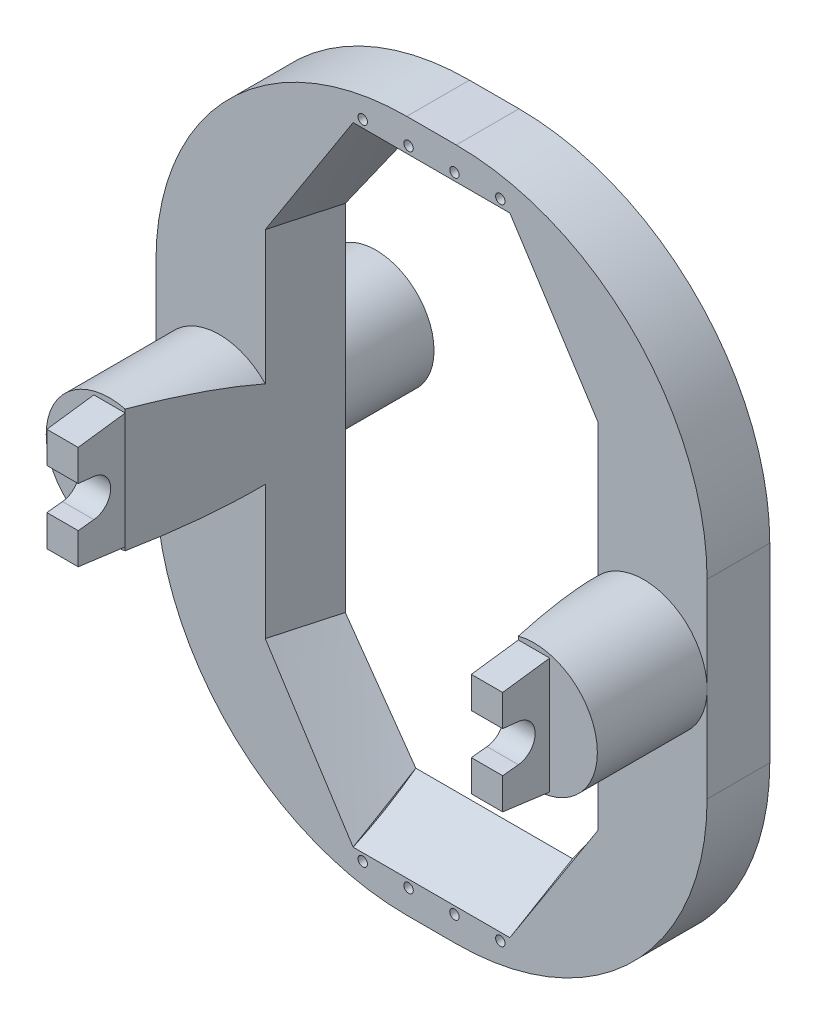
from build123d import *

# Parameters (mm, degrees)
SKETCH_1_R                      = 18.5
SKETCH_1_R_2                    = 15
EXTRUDE_1_DEPTH                 = 30
SKETCH_2_R                      = 20.2
SKETCH_2_R_2                    = 15
EXTRUDE_2_DEPTH                 = 5
SKETCH_3_R                      = 20.2
EXTRUDE_3_DEPTH                 = 50
EXTRUDE_4_DEPTH                 = 5
EXTRUDE_5_DEPTH                 = 20
FILLET_1_R                      = 80
CUT_EXTRUDE_2_REACH             = 174.924
SKETCH_7_R                      = 110
CUT_EXTRUDE_2_DIRECTION_2_REACH = 174.924
SKETCH_11_R                     = 1.5
CUT_EXTRUDE_3_DEPTH             = 25
SKETCH_12_W                     = 57.061720969
SKETCH_12_H                     = 113.011504976
CUT_EXTRUDE_4_DEPTH             = 20


with BuildPart() as part:
    # 草图1 → 凸台-拉伸1 (new body)
    with BuildSketch(Plane.XY):
        Circle(SKETCH_1_R)
        Circle(SKETCH_1_R_2, mode=Mode.SUBTRACT)
    extrude(amount=EXTRUDE_1_DEPTH)

    # 草图2 → 凸台-拉伸2 (add)
    with BuildSketch(Plane.XY.offset(30)):
        Circle(SKETCH_2_R)
        Circle(SKETCH_2_R_2, mode=Mode.SUBTRACT)
    extrude_2 = extrude(amount=EXTRUDE_2_DEPTH)

    # 草图3 → 凸台-拉伸3 (add)
    with BuildSketch(Plane.XY.offset(35)):
        Circle(SKETCH_3_R)
    extrude_3 = extrude(amount=EXTRUDE_3_DEPTH)

    # 草图5 → 凸台-拉伸4 (add, symmetric)
    with BuildSketch(Plane(origin=(0, 0, 0), x_dir=(0, -1, 0), z_dir=(1, 0, 0))):
        with BuildLine():
            Line((-18.5, -85), (18.5, -85))
            Line((18.5, -85), (16.5, -100))
            Line((16.5, -100), (6.5, -100))
            Line((6.5, -100), (5.966081527, -95))
            ThreePointArc((5.966081527, -95), (0, -89.637080228), (-5.966081527, -95))
            Line((-5.966081527, -95), (-6.5, -100))
            Line((-6.5, -100), (-16.5, -100))
            Line((-16.5, -100), (-18.5, -85))
        make_face()
    extrude_4 = extrude(amount=EXTRUDE_4_DEPTH, both=True)

    # 草图6 → 凸台-拉伸5 (add)
    with BuildSketch(Plane(origin=(0, 0, 30), x_dir=(-1, 0, 0), z_dir=(0, 0, -1))):
        Polygon((20.2, 0), (20.2, 110.346509277), (-155.6, 110.346509277), (-155.6, 0), (-155.6, -110.346509277), (20.2, -110.346509277), align=None)
        Polygon((-115.2, 56.505752488), (-92.7, 56.505752488), (-92.7, 85), (-42.7, 85), (-42.7, 56.505752488), (-20.2, 56.505752488), (-20.2, -56.505752488), (-42.7, -56.505752488), (-42.7, -85), (-92.7, -85), (-92.7, -56.505752488), (-115.2, -56.505752488), align=None, mode=Mode.SUBTRACT)
    extrude(amount=-EXTRUDE_5_DEPTH)

    # 镜向1: 凸台-拉伸2, 凸台-拉伸3, 凸台-拉伸4 across plane
    add(extrude_2.mirror(Plane.ZY.offset(-67.7)))
    add(extrude_3.mirror(Plane.ZY.offset(-67.7)))
    add(extrude_4.mirror(Plane.ZY.offset(-67.7)))

    # 圆角1
    fillet_1_edges = [part.edges().sort_by_distance(p)[0] for p in [
        (-20.2, 110.346509277, 40),
        (-20.2, -110.346509277, 40),
        (155.6, -110.346509277, 40),
        (155.6, 110.346509277, 40),
    ]]
    fillet(fillet_1_edges, radius=FILLET_1_R)

    # 切除-拉伸2: up to this face of the body (flat: up to its plane)
    cut_extrude_2_end = Plane(part.part.faces().sort_by_distance((42.7, 70.752876244, 40))[0])
    # 草图7 → 切除-拉伸2 (cut, up to the picked face)
    with BuildSketch(Plane(origin=(67.7, 0, 0), x_dir=(0, 0, -1), z_dir=(1, 0, 0)), mode=Mode.PRIVATE) as cut_extrude_2_sk1:
        with Locations((-95.637080228, 0)):
            Circle(SKETCH_7_R)
    cut_extrude_2_tool1 = split(extrude(cut_extrude_2_sk1.sketch, amount=-CUT_EXTRUDE_2_REACH, mode=Mode.PRIVATE), bisect_by=cut_extrude_2_end, keep=Keep.BOTH, mode=Mode.PRIVATE)
    add(cut_extrude_2_tool1.solids().sort_by(Axis((67.7, 0, 95.63708), (-1, 0, 0)))[0], mode=Mode.SUBTRACT)

    # 切除-拉伸2 direction 2: up to this face of the body (flat: up to its plane)
    cut_extrude_2_direction_2_end = Plane(part.part.faces().sort_by_distance((92.7, 70.752876244, 40))[0])
    # 草图7 → 切除-拉伸2 direction 2 (cut, up to the picked face)
    with BuildSketch(Plane(origin=(67.7, 0, 0), x_dir=(0, 0, -1), z_dir=(1, 0, 0)), mode=Mode.PRIVATE) as cut_extrude_2_direction_2_sk1:
        with Locations((-95.637080228, 0)):
            Circle(SKETCH_7_R)
    cut_extrude_2_direction_2_tool1 = split(extrude(cut_extrude_2_direction_2_sk1.sketch, amount=CUT_EXTRUDE_2_DIRECTION_2_REACH, mode=Mode.PRIVATE), bisect_by=cut_extrude_2_direction_2_end, keep=Keep.BOTH, mode=Mode.PRIVATE)
    add(cut_extrude_2_direction_2_tool1.solids().sort_by(Axis((67.7, 0, 95.63708), (1, 0, 0)))[0], mode=Mode.SUBTRACT)

    # 草图11 → 切除-拉伸3 (cut)
    with BuildSketch(Plane(origin=(0, 0, 30), x_dir=(-1, 0, 0), z_dir=(0, 0, -1))):
        with Locations((-89.646136586, -102.489523561)):
            Circle(SKETCH_11_R)
        with Locations((-75.015378862, -102.489523561)):
            Circle(SKETCH_11_R)
        with Locations((-60.384621138, -102.489523561)):
            Circle(SKETCH_11_R)
        with Locations((-45.753863414, -102.489523561)):
            Circle(SKETCH_11_R)
    cut_extrude_3 = extrude(amount=-CUT_EXTRUDE_3_DEPTH, mode=Mode.SUBTRACT)

    # 镜向2: 切除-拉伸3 across plane
    add(cut_extrude_3.mirror(Plane.ZX), mode=Mode.SUBTRACT)

    # 草图12 → 切除-拉伸4 (cut)
    with BuildSketch(Plane(origin=(26.469269419, 0, 7.315143549), x_dir=(0.26637822592359434, 0, -0.9638685806445808), z_dir=(0.9638685806445808, 0, 0.26637822592359434))):
        with Locations((-52.066077741, 0)):
            Rectangle(SKETCH_12_W, SKETCH_12_H)
    cut_extrude_4 = extrude(amount=CUT_EXTRUDE_4_DEPTH, mode=Mode.SUBTRACT)

    # 镜向3: 切除-拉伸4 across plane
    add(cut_extrude_4.mirror(Plane.ZY.offset(-67.7)), mode=Mode.SUBTRACT)

    # 草图14 → 切除-放样1 section 0
    with BuildSketch(Plane.XY.offset(50)):
        with BuildLine():
            Line((14.672727273, 56.505752488), (42.7, 100.086247348))
            Line((42.7, 100.086247348), (92.7, 100.086247348))
            Line((92.7, 100.086247348), (120.727272727, 56.505752488))
            Line((120.727272727, 56.505752488), (120.727272727, -56.505752488))
            Line((120.727272727, -56.505752488), (92.7, -100.086247348))
            Line((92.7, -100.086247348), (42.7, -100.086247348))
            Line((42.7, -100.086247348), (14.672727273, -56.505752488))
            Line((14.672727273, -56.505752488), (14.672727273, 56.505752488))
        make_face()
    # 草图15 → 切除-放样1 section 1
    with BuildSketch(Plane(origin=(0, 0, 30), x_dir=(-1, 0, 0), z_dir=(0, 0, -1))):
        with BuildLine():
            Line((-92.7, 88.27102412), (-115.2, 56.505752488))
            Line((-115.2, 56.505752488), (-115.2, -56.505752488))
            Line((-115.2, -56.505752488), (-92.7, -88.27102412))
            Line((-92.7, -88.27102412), (-42.7, -88.27102412))
            Line((-42.7, -88.27102412), (-20.2, -56.505752488))
            Line((-20.2, -56.505752488), (-20.2, 56.505752488))
            Line((-20.2, 56.505752488), (-42.7, 88.27102412))
            Line((-42.7, 88.27102412), (-92.7, 88.27102412))
        make_face()
    loft(mode=Mode.SUBTRACT)


solid = part.part
